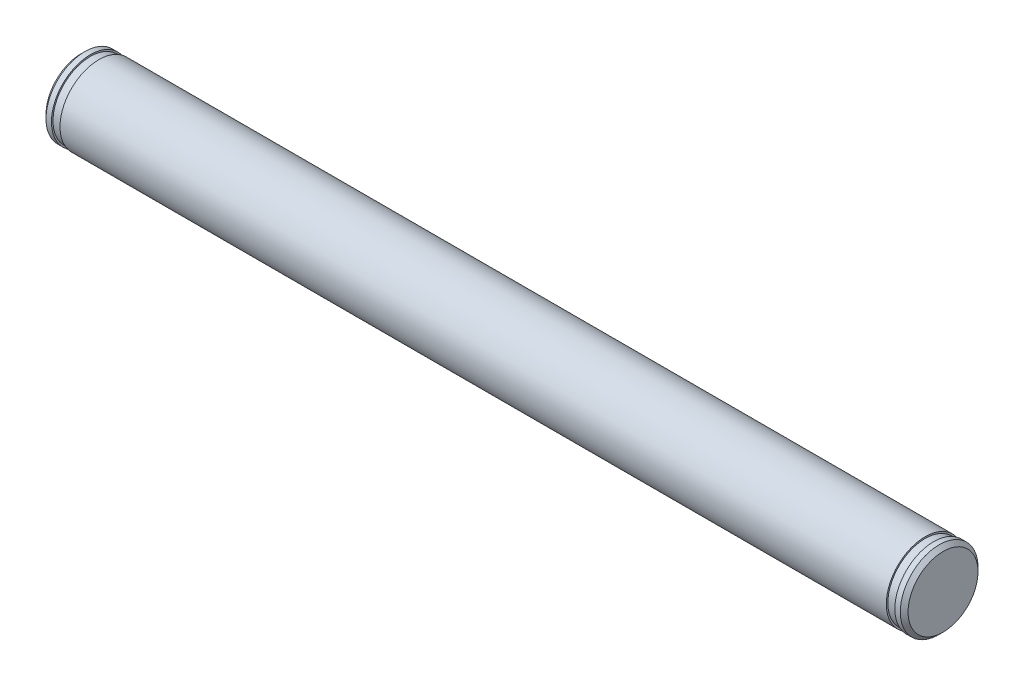
from build123d import *

# Parameters (mm, degrees)
CHAMFER_1_SIZE = 0.5


with BuildPart() as part:
    # 草图1 → 旋转1 (revolve)
    with BuildSketch(Plane.XY):
        Polygon((55.45, 0), (55.45, 5), (54.25, 5), (54.25, 4.8), (53.15, 4.8), (53.15, 5), (-53.15, 5), (-53.15, 4.8), (-54.25, 4.8), (-54.25, 5), (-55.45, 5), (-55.45, 0), align=None)
    revolve(axis=Axis((55.45, 0, 0), (-1, 0, 0)))

    # 倒角1
    chamfer_1_edges = [part.edges().sort_by_distance(p)[0] for p in [
        (-55.45, -5, 0),
        (55.45, -5, 0),
    ]]
    chamfer(chamfer_1_edges, length=CHAMFER_1_SIZE)


solid = part.part
